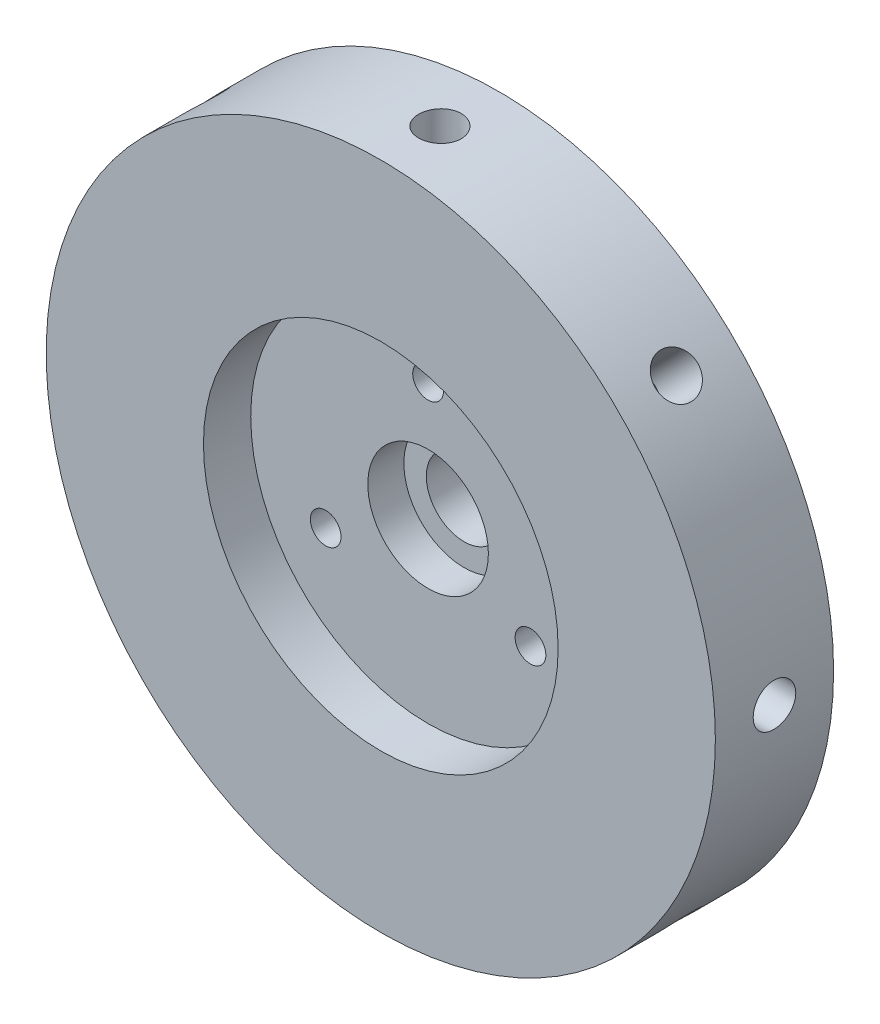
from build123d import *

# Parameters (mm, degrees)
SKETCH_1_R               = 20
EXTRUDE_1_DEPTH          = 0.0001
SKETCH_2_R               = 4.35
EXTRUDE_2_DEPTH          = 1
SKETCH_3_R               = 3.85
EXTRUDE_3_DEPTH          = 5.5
SKETCH_7_R               = 28.3
EXTRUDE_4_DEPTH          = 10
PATTERN_CIRCULAR_2_COUNT = 8
SKETCH_20_R              = 4
SKETCH_20_R_2            = 3.5
EXTRUDE_5_DEPTH          = 2
SKETCH_21_R              = 3.2
CUT_EXTRUDE_1_DEPTH      = 42.252660699
SKETCH_22_R              = 15
CUT_EXTRUDE_2_DEPTH      = 4
SKETCH_23_R              = 5.1
CUT_EXTRUDE_3_DEPTH      = 3.05
HOLE_WIZARD_M2_1_D       = 2.6
HOLE_WIZARD_M2_1_DEPTH   = 3
HOLE_WIZARD_M2_1_TIP     = 0.781118805
SKETCH_28_R              = 2.2
CUT_EXTRUDE_4_DEPTH      = 5.5


with BuildPart() as part:
    # 스케치1 → 보스-돌출1 (new body)
    with BuildSketch(Plane.XY):
        Circle(SKETCH_1_R)
    extrude(amount=EXTRUDE_1_DEPTH)

    # 스케치2 → 보스-돌출2 (add)
    with BuildSketch(Plane(origin=(0, 0, 0), x_dir=(-1, 0, 0), z_dir=(0, 0, -1))):
        with Locations(Location((0, 14.33, 0), (0, 0, 180))):
            Circle(SKETCH_2_R)
        with Locations(Location((-12.410144036, -7.165, 0), (0, 0, 180))):
            Circle(SKETCH_2_R)
        with Locations(Location((12.410144036, -7.165, 0), (0, 0, 180))):
            Circle(SKETCH_2_R)
    extrude(amount=EXTRUDE_2_DEPTH)

    # 스케치3 → 보스-돌출3 (add)
    with BuildSketch(Plane(origin=(0, 0, -1), x_dir=(-1, 0, 0), z_dir=(0, 0, -1))):
        with Locations((0, 14.33)):
            Circle(SKETCH_3_R)
        with Locations((-12.410144036, -7.165)):
            Circle(SKETCH_3_R)
        with Locations((12.410144036, -7.165)):
            Circle(SKETCH_3_R)
    extrude(amount=EXTRUDE_3_DEPTH)

    # 스케치7 → 보스-돌출4 (add)
    with BuildSketch(Plane.XY.offset(0.0001)):
        Circle(SKETCH_7_R)
    extrude(amount=EXTRUDE_4_DEPTH)

    # 스케치19 → M3 여유 구멍5 (revolve, cut)
    with BuildSketch(Plane(origin=(0, 28.3, 5.0001), x_dir=(0, 0, 1), z_dir=(1, 0, 0))):
        Polygon((0, 0), (0, 6.081549114), (1.8, 5), (1.8, 0), align=None)
    hole_wizard_m3_5 = revolve(axis=Axis((0, 34.65, 5.0001), (0, -1, 0)), mode=Mode.SUBTRACT)

    # 원형 패턴2: M3 여유 구멍5 ×8 about axis
    pattern_circular_2_axis = Axis((0, 0, 10.0001), (0, 0, 1))
    for i in range(1, PATTERN_CIRCULAR_2_COUNT):
        add(hole_wizard_m3_5.rotate(pattern_circular_2_axis, i * 360 / PATTERN_CIRCULAR_2_COUNT), mode=Mode.SUBTRACT)

    # 스케치20 → 보스-돌출5 (add)
    with BuildSketch(Plane(origin=(0, 0, 0), x_dir=(-1, 0, 0), z_dir=(0, 0, -1))):
        with Locations(Location((0, 0, 0), (0, 0, 180))):
            Circle(SKETCH_20_R)
        Circle(SKETCH_20_R_2, mode=Mode.SUBTRACT)
    extrude(amount=EXTRUDE_5_DEPTH)

    # 스케치21 → 컷-돌출1 (cut, through all)
    with BuildSketch(Plane(origin=(0, 0, 0), x_dir=(-1, 0, 0), z_dir=(0, 0, -1))):
        Circle(SKETCH_21_R)
    extrude(amount=-CUT_EXTRUDE_1_DEPTH, mode=Mode.SUBTRACT)

    # 스케치22 → 컷-돌출2 (cut)
    with BuildSketch(Plane.XY.offset(10.0001)):
        Circle(SKETCH_22_R)
    extrude(amount=-CUT_EXTRUDE_2_DEPTH, mode=Mode.SUBTRACT)

    # 스케치23 → 컷-돌출3 (cut)
    with BuildSketch(Plane.XY.offset(6.0001)):
        Circle(SKETCH_23_R)
    extrude(amount=-CUT_EXTRUDE_3_DEPTH, mode=Mode.SUBTRACT)

    # M2 여유 구멍1
    with Locations(Plane(origin=(0, 10, 6.0001), x_dir=(1, 0, 0), z_dir=(0, 0, 1))):
        with Locations((0, 0), (-8.660254038, -15), (8.660254038, -15)):
            Hole(HOLE_WIZARD_M2_1_D / 2, depth=HOLE_WIZARD_M2_1_DEPTH)
            with Locations((0, 0, -(HOLE_WIZARD_M2_1_DEPTH + HOLE_WIZARD_M2_1_TIP / 2))):  # 118° drill point
                Cone(0, HOLE_WIZARD_M2_1_D / 2, HOLE_WIZARD_M2_1_TIP, mode=Mode.SUBTRACT)

    # 스케치28 → 컷-돌출4 (cut)
    with BuildSketch(Plane(origin=(0, 0, -6.5), x_dir=(-1, 0, 0), z_dir=(0, 0, -1))):
        with Locations((0, 14.33)):
            Circle(SKETCH_28_R)
        with Locations((-12.410144036, -7.165)):
            Circle(SKETCH_28_R)
        with Locations((12.410144036, -7.165)):
            Circle(SKETCH_28_R)
    extrude(amount=-CUT_EXTRUDE_4_DEPTH, mode=Mode.SUBTRACT)


solid = part.part
